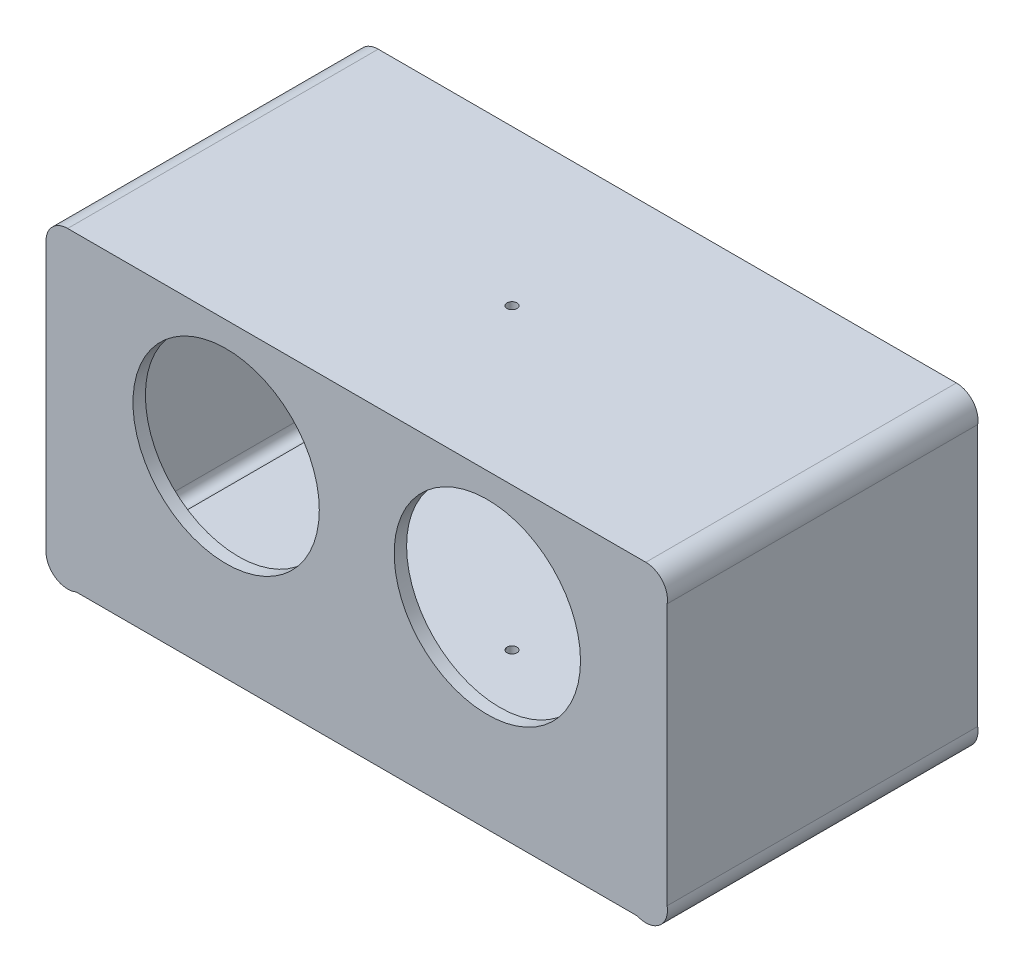
from build123d import *

# Parameters (mm, degrees)
SKETCH1_R               = 7.5
BOSS_EXTRUDE2_DEPTH     = 25
CUT_EXTRUDE1_DEPTH      = 24
CUT_EXTRUDE2_DEPTH      = 27
CUT_EXTRUDE2_DEPTH_BACK = 36
SKETCH3_R               = 0.4
SKETCH4_R               = 7
BOSS_EXTRUDE3_DEPTH     = 1
CUT_EXTRUDE3_START      = -11
SKETCH5_R               = 0.4
CUT_EXTRUDE3_DEPTH      = 11


with BuildPart() as part:
    # Sketch1 → Boss-Extrude2 (new body)
    with BuildSketch(Plane.XY):
        with BuildLine():
            ThreePointArc((2.414315168, 0.069999392), (0.769305306, 0.218548989), (-0.013240201, 1.673109733))
            Line((-0.013240201, 1.673109733), (-0.013240201, 23.326890267))
            ThreePointArc((-0.013240201, 23.326890267), (0.497304642, 24.55945455), (1.729868925, 25.069999392))
            Line((1.729868925, 25.069999392), (48.270131075, 25.069999392))
            ThreePointArc((48.270131075, 25.069999392), (49.605427649, 24.447342177), (49.986759799, 23.02421016))
            Line((49.986759799, 23.02421016), (49.986759799, 1.97578984))
            ThreePointArc((49.986759799, 1.97578984), (49.353809753, 0.307800264), (47.585684832, 0.069999392))
            Line((47.585684832, 0.069999392), (2.414315168, 0.069999392))
        make_face()
        with Locations((14.486759799, 15.569999392)):
            Circle(SKETCH1_R, mode=Mode.SUBTRACT)
        with Locations((35.513240201, 15.569999392)):
            Circle(SKETCH1_R, mode=Mode.SUBTRACT)
    extrude(amount=-BOSS_EXTRUDE2_DEPTH)

    # Sketch2 → Cut-Extrude1 (cut)
    with BuildSketch(Plane(origin=(0, 0, -25), x_dir=(-1, 0, 0), z_dir=(0, 0, -1))):
        with BuildLine():
            Line((-0.986759799, 1.673109733), (-0.986759799, 23.326890267))
            ThreePointArc((-0.986759799, 23.326890267), (-1.204411423, 23.852347769), (-1.729868925, 24.069999392))
            Line((-1.729868925, 24.069999392), (-48.270131075, 24.069999392))
            ThreePointArc((-48.270131075, 24.069999392), (-48.861025261, 23.777506771), (-48.986759799, 23.130282932))
            Line((-48.986759799, 23.130282932), (-48.986759799, 1.869717068))
            ThreePointArc((-48.986759799, 1.869717068), (-48.694204694, 1.062886218), (-47.836000807, 1.069999392))
            Line((-47.836000807, 1.069999392), (-2.163999193, 1.069999392))
            ThreePointArc((-2.163999193, 1.069999392), (-1.391043742, 1.011740949), (-0.986759799, 1.673109733))
        make_face()
    extrude(amount=-CUT_EXTRUDE1_DEPTH, mode=Mode.SUBTRACT)

    # Sketch3 → Cut-Extrude2 (cut, two sides: drawn at the far end of the back side and taken through both)
    with BuildSketch(Plane.XZ.offset(-0.069999392).offset(-CUT_EXTRUDE2_DEPTH_BACK)):
        with Locations(Location((25, -12.5, 0), (0, 0, 180))):
            Circle(SKETCH3_R)
    extrude(amount=CUT_EXTRUDE2_DEPTH + CUT_EXTRUDE2_DEPTH_BACK, mode=Mode.SUBTRACT)

    # Sketch4 → Boss-Extrude3 (add)
    with BuildSketch(Plane.XZ.offset(-0.069999392)):
        with Locations((25, -12.5)):
            Circle(SKETCH4_R)
    extrude(amount=BOSS_EXTRUDE3_DEPTH)

    # Sketch5 → Cut-Extrude3 (cut)
    with BuildSketch(Plane(origin=(0, 1.069999392, 0), x_dir=(1, 0, 0), z_dir=(0, 1, 0)).offset(CUT_EXTRUDE3_START)):
        with Locations(Location((25, 12.5, 0), (0, 0, 180))):
            Circle(SKETCH5_R)
    extrude(amount=CUT_EXTRUDE3_DEPTH, mode=Mode.SUBTRACT)


solid = part.part
